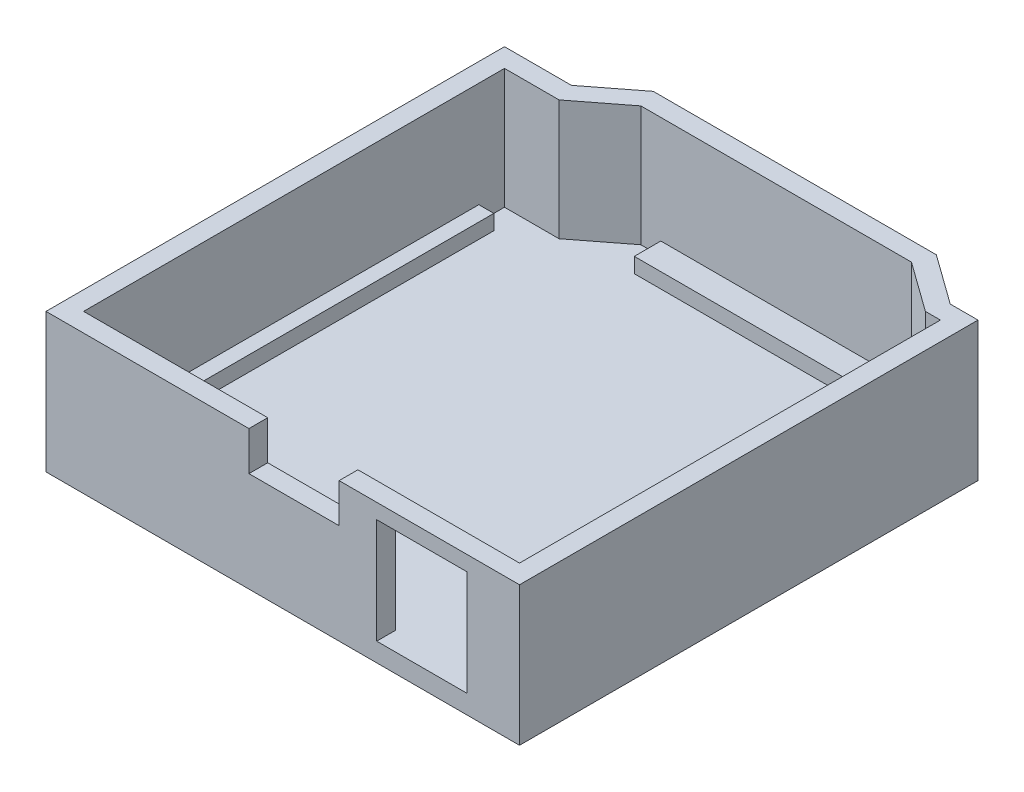
from build123d import *

# Parameters (mm, degrees)
BOSS_EXTRUDE1_DEPTH = 16
SHELL1_T            = 2.5
SKETCH2_W           = 12
SKETCH2_H           = 14
SKETCH2_H_2         = 5.195244662
CUT_EXTRUDE1_DEPTH  = 4
SKETCH3_W           = 2
SKETCH3_H           = 50
SKETCH3_W_2         = 1.814522713
BOSS_EXTRUDE2_DEPTH = 2
SKETCH4_W           = 31.017616101
SKETCH4_H           = 3.530460369
BOSS_EXTRUDE3_DEPTH = 2


with BuildPart() as part:
    # Sketch1 → Boss-Extrude1 (new body)
    with BuildSketch(Plane(origin=(0, 0, 0), x_dir=(1, 0, 0), z_dir=(0, 1, 0))):
        Polygon((0, 0), (0, 56), (7.260584432, 56), (13.399361706, 60.750217247), (49.399361706, 60.750217247), (56, 56), (58, 56), (58, 0), align=None)
    extrude(amount=BOSS_EXTRUDE1_DEPTH)

    # Shell1
    shell1_openings = [part.faces().sort_by_distance(p)[0] for p in [
        (29.147078279, 16, -29.765448683),
    ]]
    offset(amount=SHELL1_T, openings=shell1_openings, kind=Kind.INTERSECTION)

    # Sketch2 → Cut-Extrude1 (cut)
    with BuildSketch(Plane(origin=(0, 0, 0), x_dir=(-1, 0, 0), z_dir=(0, 0, -1))):
        with Locations((-47.5, 7)):
            Rectangle(SKETCH2_W, SKETCH2_H)
        with Locations((-30.5, 13.402377669)):
            Rectangle(SKETCH2_W, SKETCH2_H_2)
    extrude(amount=-CUT_EXTRUDE1_DEPTH, mode=Mode.SUBTRACT)

    # Sketch3 → Boss-Extrude2 (add)
    with BuildSketch(Plane(origin=(0, 0, 0), x_dir=(1, 0, 0), z_dir=(0, 1, 0))):
        with Locations((1, 27.58353092)):
            Rectangle(SKETCH3_W, SKETCH3_H)
        with Locations((56.968981121, 27.58353092)):
            Rectangle(SKETCH3_W_2, SKETCH3_H)
    extrude(amount=BOSS_EXTRUDE2_DEPTH)

    # Sketch4 → Boss-Extrude3 (add)
    with BuildSketch(Plane(origin=(0, 0, 0), x_dir=(1, 0, 0), z_dir=(0, 1, 0))):
        with Locations((31.80262956, 58.741489624)):
            Rectangle(SKETCH4_W, SKETCH4_H)
    extrude(amount=BOSS_EXTRUDE3_DEPTH)


solid = part.part
